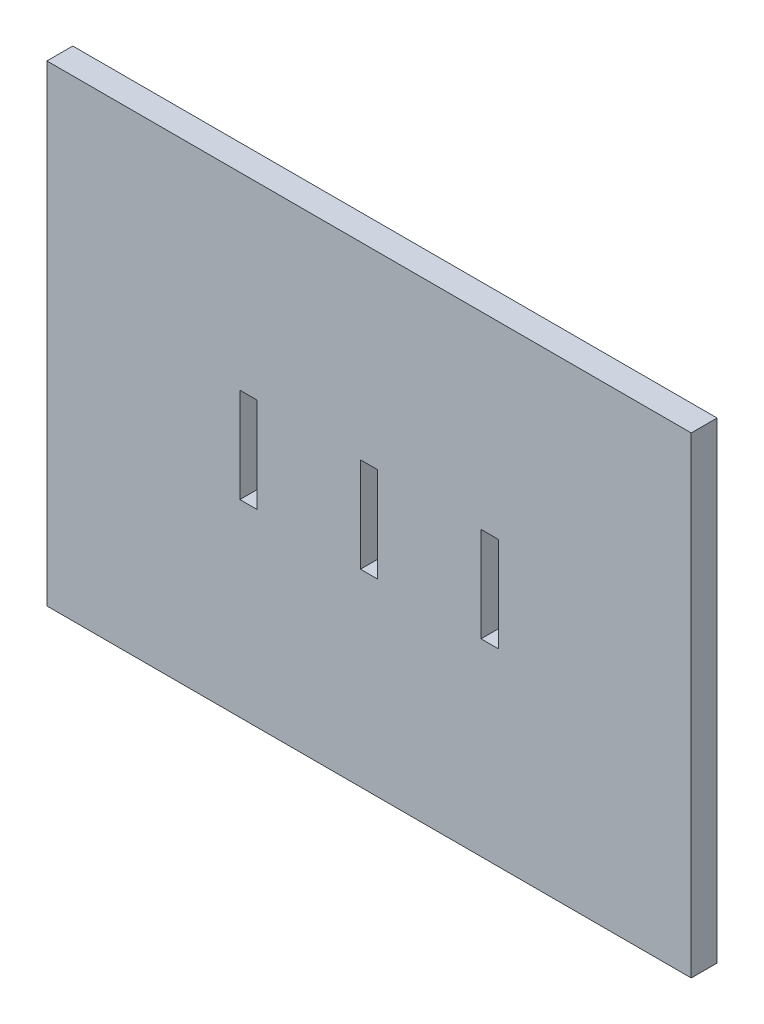
from build123d import *

# Parameters (mm, degrees)
SKETCH1_W           = 27.4
SKETCH1_H           = 37.4
SKETCH1_W_2         = 5.5
SKETCH1_H_2         = 1
BOSS_EXTRUDE1_DEPTH = 1.5


with BuildPart() as part:
    # Sketch1 → Boss-Extrude1 (new body)
    with BuildSketch(Plane(origin=(0, 0, 0), x_dir=(0, 1, 0), z_dir=(0, 0, 1))):
        Rectangle(SKETCH1_W, SKETCH1_H)
        Rectangle(SKETCH1_W_2, SKETCH1_H_2, mode=Mode.SUBTRACT)
        with Locations((0, 7)):
            Rectangle(SKETCH1_W_2, SKETCH1_H_2, mode=Mode.SUBTRACT)
        with Locations((0, -7)):
            Rectangle(SKETCH1_W_2, SKETCH1_H_2, mode=Mode.SUBTRACT)
    extrude(amount=BOSS_EXTRUDE1_DEPTH)


solid = part.part
